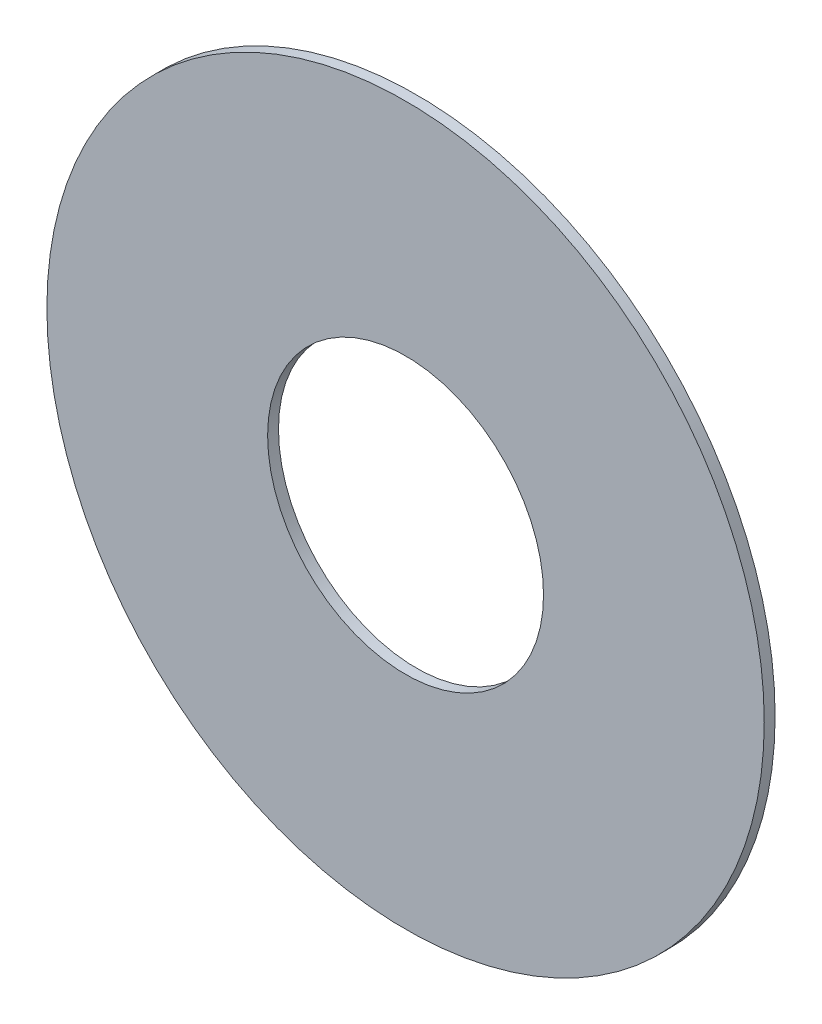
from build123d import *

# Parameters (mm, degrees)
SKETCH1_R           = 165.1
SKETCH1_R_2         = 63.5
BOSS_EXTRUDE1_DEPTH = 5


with BuildPart() as part:
    # Sketch1 → Boss-Extrude1 (new body)
    with BuildSketch(Plane.XY):
        Circle(SKETCH1_R)
        Circle(SKETCH1_R_2, mode=Mode.SUBTRACT)
    extrude(amount=BOSS_EXTRUDE1_DEPTH)


solid = part.part
